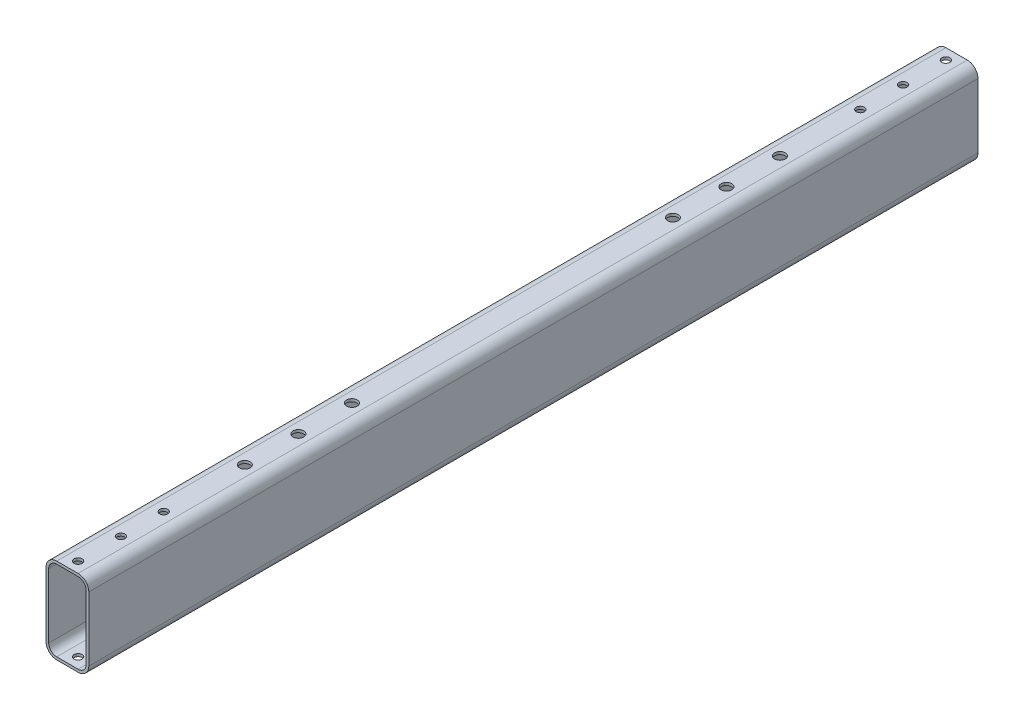
from build123d import *

# Parameters (mm, degrees)
EXTRUDE_THIN1_DEPTH               = 527.685
F_3_16_0_1875_DIAMETER_HOLE1_D    = 4.7625
F_3_16_0_195_DIAMETER_HOLE1_D     = 4.953
F_3_16_0_195_DIAMETER_HOLE1_DEPTH = 1.5875
F_1_4_0_25_DIAMETER_HOLE1_D       = 6.35
F_1_4_0_25_DIAMETER_HOLE1_DEPTH   = 25.4
F_1_4_0_25_DIAMETER_HOLE1_TIP     = 1.907732465


with BuildPart() as part:
    # Sketch1 → Extrude-Thin1 (new body)
    with BuildSketch(Plane.XY):
        with BuildLine():
            Line((-12.7, 19.05), (-12.7, -19.05))
            ThreePointArc((-12.7, -19.05), (-10.840128061, -23.540128061), (-6.35, -25.4))
            Line((-6.35, -25.4), (6.35, -25.4))
            ThreePointArc((6.35, -25.4), (10.840128061, -23.540128061), (12.7, -19.05))
            Line((12.7, -19.05), (12.7, 19.05))
            ThreePointArc((12.7, 19.05), (10.840128061, 23.540128061), (6.35, 25.4))
            Line((6.35, 25.4), (-6.35, 25.4))
            ThreePointArc((-6.35, 25.4), (-10.840128061, 23.540128061), (-12.7, 19.05))
        make_face()
        with BuildLine():
            Line((-11.1125, 19.05), (-11.1125, -19.05))
            ThreePointArc((-11.1125, -19.05), (-9.717596045, -22.417596045), (-6.35, -23.8125))
            Line((-6.35, -23.8125), (6.35, -23.8125))
            ThreePointArc((6.35, -23.8125), (9.717596045, -22.417596045), (11.1125, -19.05))
            Line((11.1125, -19.05), (11.1125, 19.05))
            ThreePointArc((11.1125, 19.05), (9.717596045, 22.417596045), (6.35, 23.8125))
            Line((6.35, 23.8125), (-6.35, 23.8125))
            ThreePointArc((-6.35, 23.8125), (-9.717596045, 22.417596045), (-11.1125, 19.05))
        make_face(mode=Mode.SUBTRACT)
    extrude(amount=EXTRUDE_THIN1_DEPTH)

    # 3/16 (0.1875) Diameter Hole1 (through all)
    with Locations(Plane(origin=(0, 25.4, 521.335), x_dir=(0, 0, 1), z_dir=(0, 1, 0))):
        with Locations((0, 0), (-514.985, 0), (-489.585, 0), (-464.185, 0), (-25.4, 0), (-50.8, 0)):
            Hole(F_3_16_0_1875_DIAMETER_HOLE1_D / 2)

    # 3/16 (0.195) Diameter Hole1
    with Locations(Plane(origin=(0, -25.4, 0), x_dir=(-1, 0, 0), z_dir=(0, -1, 0))):
        with Locations((3.175, -115.479743879), (-3.175, -140.879743879), (3.175, -166.279743879), (-3.175, -191.679743879), (-3.175, -344.079743879), (3.175, -369.479743879), (-3.175, -394.879743879), (3.175, -420.279743879)):
            Hole(F_3_16_0_195_DIAMETER_HOLE1_D / 2, depth=F_3_16_0_195_DIAMETER_HOLE1_DEPTH)

    # 1/4 (0.25) Diameter Hole1
    with Locations(Plane(origin=(0, 25.4, 0), x_dir=(1, 0, 0), z_dir=(0, 1, 0))):
        with Locations((0, -104.85), (0, -136.6), (0, -168.35), (0, -422.374806202), (0, -390.624806202), (0, -358.874806202)):
            Hole(F_1_4_0_25_DIAMETER_HOLE1_D / 2, depth=F_1_4_0_25_DIAMETER_HOLE1_DEPTH)
            with Locations((0, 0, -(F_1_4_0_25_DIAMETER_HOLE1_DEPTH + F_1_4_0_25_DIAMETER_HOLE1_TIP / 2))):  # 118° drill point
                Cone(0, F_1_4_0_25_DIAMETER_HOLE1_D / 2, F_1_4_0_25_DIAMETER_HOLE1_TIP, mode=Mode.SUBTRACT)


solid = part.part
